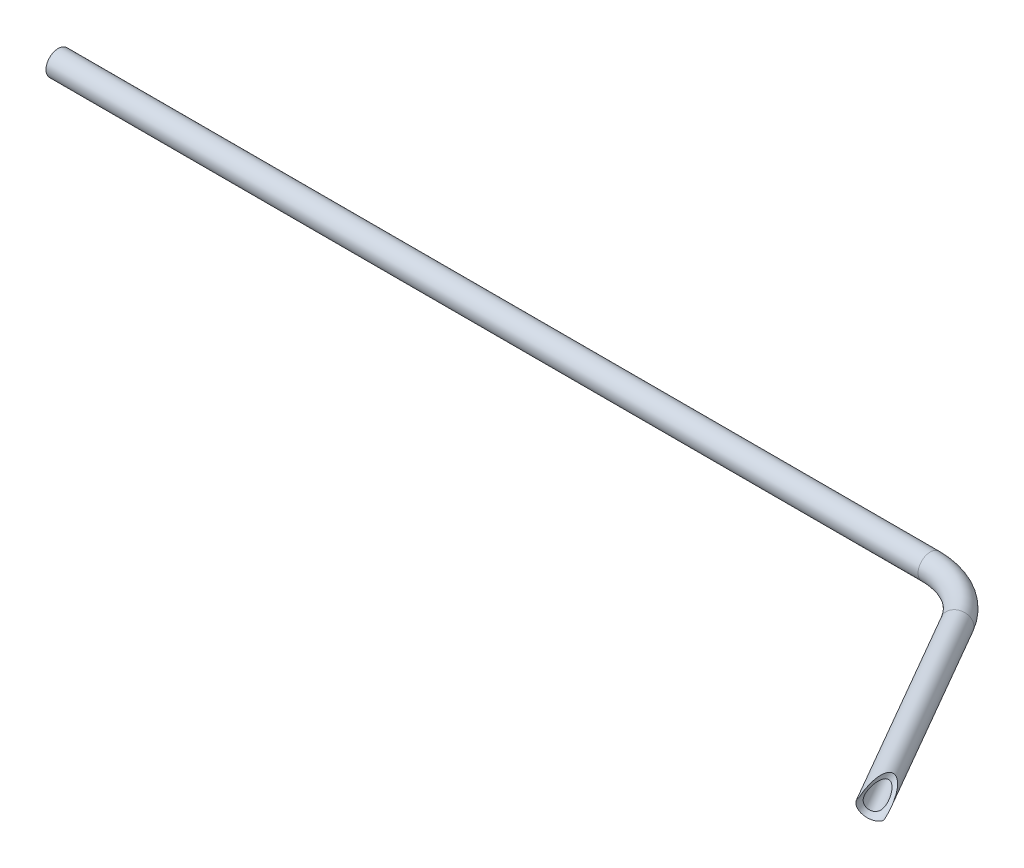
from build123d import *

# Parameters (mm, degrees)
SKETCH2_R               = 50
SKETCH2_R_2             = 35
CUT_EXTRUDE1_DEPTH      = 4422.603744923
CUT_EXTRUDE1_DEPTH_BACK = 4422.603744923
SKETCH5_R               = 50


with BuildPart() as part:
    # Sweep1: sweep along a path in Sketch1
    with BuildLine(Plane(origin=(0, 0, 0), x_dir=(1, 0, 0), z_dir=(0, 1, 0))) as sweep1_path:
        Line((0, 0), (3561.782625306, 0))
        ThreePointArc((3561.782625306, 0), (3711.782625306, -40.192378865), (3821.590246441, -150))
        Line((3821.590246441, -150), (4300, -978.63))
    # Sketch2 → Sweep1 (sweep)
    with BuildSketch(Plane(origin=(0, 0, 0), x_dir=(0, 0, -1), z_dir=(1, 0, 0))):
        Circle(SKETCH2_R)
        Circle(SKETCH2_R_2, mode=Mode.SUBTRACT)
    sweep(path=sweep1_path.line)

    # Sketch5 → Cut-Extrude1 (cut, two sides: drawn at the far end of the back side and taken through both)
    with BuildSketch(Plane(origin=(4300, 0, 978.63), x_dir=(1, 0, 0), z_dir=(0, 0.495590774858731, -0.8685561489477365)).offset(-CUT_EXTRUDE1_DEPTH_BACK)):
        Circle(SKETCH5_R)
    extrude(amount=CUT_EXTRUDE1_DEPTH + CUT_EXTRUDE1_DEPTH_BACK, mode=Mode.SUBTRACT)


solid = part.part
